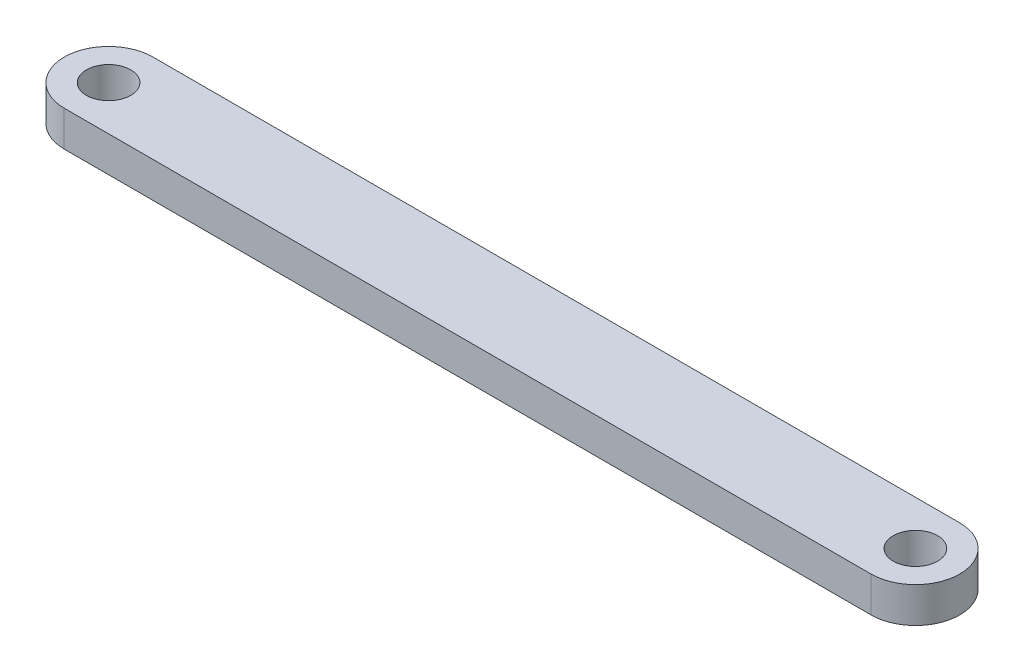
from build123d import *

# Parameters (mm, degrees)
CROQUIS1_R              = 12.5
SALIENTE_EXTRUIR1_DEPTH = 20


with BuildPart() as part:
    # Croquis1 → Saliente-Extruir1 (new body)
    with BuildSketch(Plane(origin=(0, 0, 0), x_dir=(1, 0, 0), z_dir=(0, 1, 0))):
        with BuildLine():
            ThreePointArc((0, 25), (-25, 0), (0, -25))
            Line((0, -25), (455, -25))
            ThreePointArc((455, -25), (480, 0), (455, 25))
            Line((455, 25), (0, 25))
        make_face()
        with Locations(Location((0, 0, 0), (0, 0, 270))):
            Circle(CROQUIS1_R, mode=Mode.SUBTRACT)
        with Locations(Location((455, 0, 0), (0, 0, 270))):
            Circle(CROQUIS1_R, mode=Mode.SUBTRACT)
    extrude(amount=SALIENTE_EXTRUIR1_DEPTH)


solid = part.part
